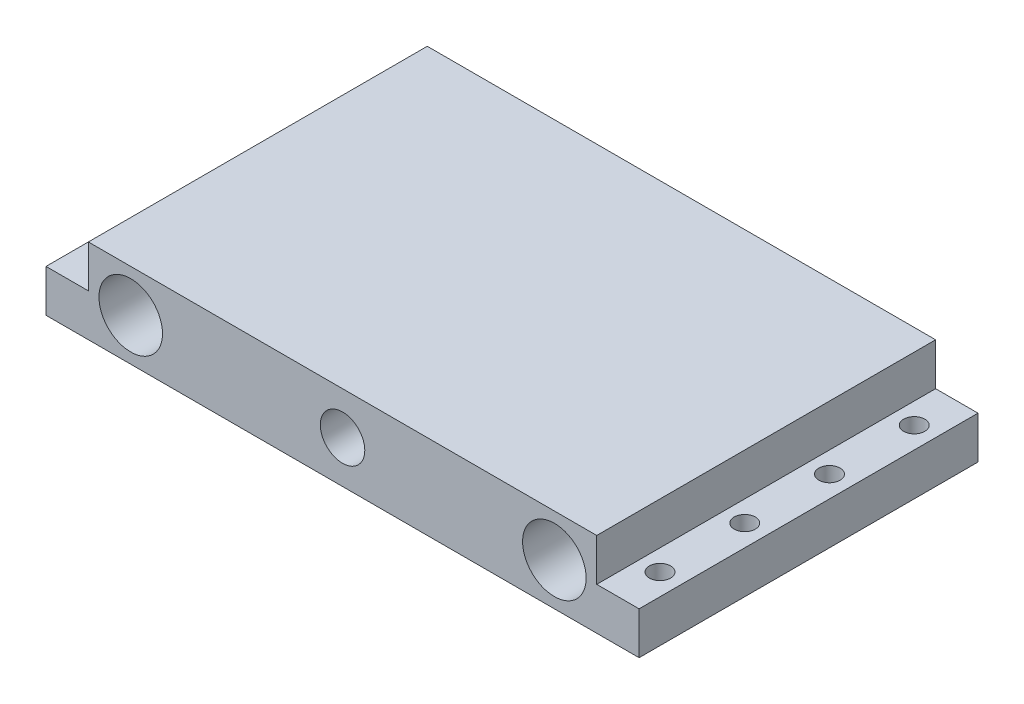
from build123d import *

# Parameters (mm, degrees)
SKETCH1_W           = 140
SKETCH1_H           = 20
BOSS_EXTRUDE1_DEPTH = 80
SKETCH2_W           = 10
SKETCH2_H           = 80
CUT_EXTRUDE1_DEPTH  = 10
SKETCH3_R           = 7.5
SKETCH3_R_2         = 5.25
CUT_EXTRUDE2_DEPTH  = 80
SKETCH4_R           = 2.5
CUT_EXTRUDE4_DEPTH  = 440


with BuildPart() as part:
    # Sketch1 → Boss-Extrude1 (new body)
    with BuildSketch(Plane.XY):
        with Locations((70, -10)):
            Rectangle(SKETCH1_W, SKETCH1_H)
    extrude(amount=BOSS_EXTRUDE1_DEPTH)

    # Sketch2 → Cut-Extrude1 (cut)
    with BuildSketch(Plane(origin=(0, 0, 0), x_dir=(1, 0, 0), z_dir=(0, 1, 0))):
        with Locations((135, -40)):
            Rectangle(SKETCH2_W, SKETCH2_H)
        with Locations((5, -40)):
            Rectangle(SKETCH2_W, SKETCH2_H)
    extrude(amount=-CUT_EXTRUDE1_DEPTH, mode=Mode.SUBTRACT)

    # Sketch3 → Cut-Extrude2 (cut)
    with BuildSketch(Plane.XY.offset(80)):
        with Locations((20, -10)):
            Circle(SKETCH3_R)
        with Locations((70, -10)):
            Circle(SKETCH3_R_2)
        with Locations((120, -10)):
            Circle(SKETCH3_R)
    extrude(amount=-CUT_EXTRUDE2_DEPTH, mode=Mode.SUBTRACT)

    # Sketch4 → Cut-Extrude4 (cut)
    with BuildSketch(Plane(origin=(0, -10, 0), x_dir=(1, 0, 0), z_dir=(0, 1, 0))):
        with Locations(Location((5.056286957, -10, 0), (0, 0, 270))):
            Circle(SKETCH4_R)
        with Locations(Location((5.056286957, -30, 0), (0, 0, 270))):
            Circle(SKETCH4_R)
        with Locations(Location((5.056286957, -50, 0), (0, 0, 270))):
            Circle(SKETCH4_R)
        with Locations(Location((5.056286957, -70, 0), (0, 0, 270))):
            Circle(SKETCH4_R)
        with Locations(Location((134.943713043, -70, 0), (0, 0, 270))):
            Circle(SKETCH4_R)
        with Locations(Location((134.943713043, -50, 0), (0, 0, 270))):
            Circle(SKETCH4_R)
        with Locations(Location((134.943713043, -30, 0), (0, 0, 270))):
            Circle(SKETCH4_R)
        with Locations(Location((134.943713043, -10, 0), (0, 0, 270))):
            Circle(SKETCH4_R)
    extrude(amount=-CUT_EXTRUDE4_DEPTH, mode=Mode.SUBTRACT)


solid = part.part
